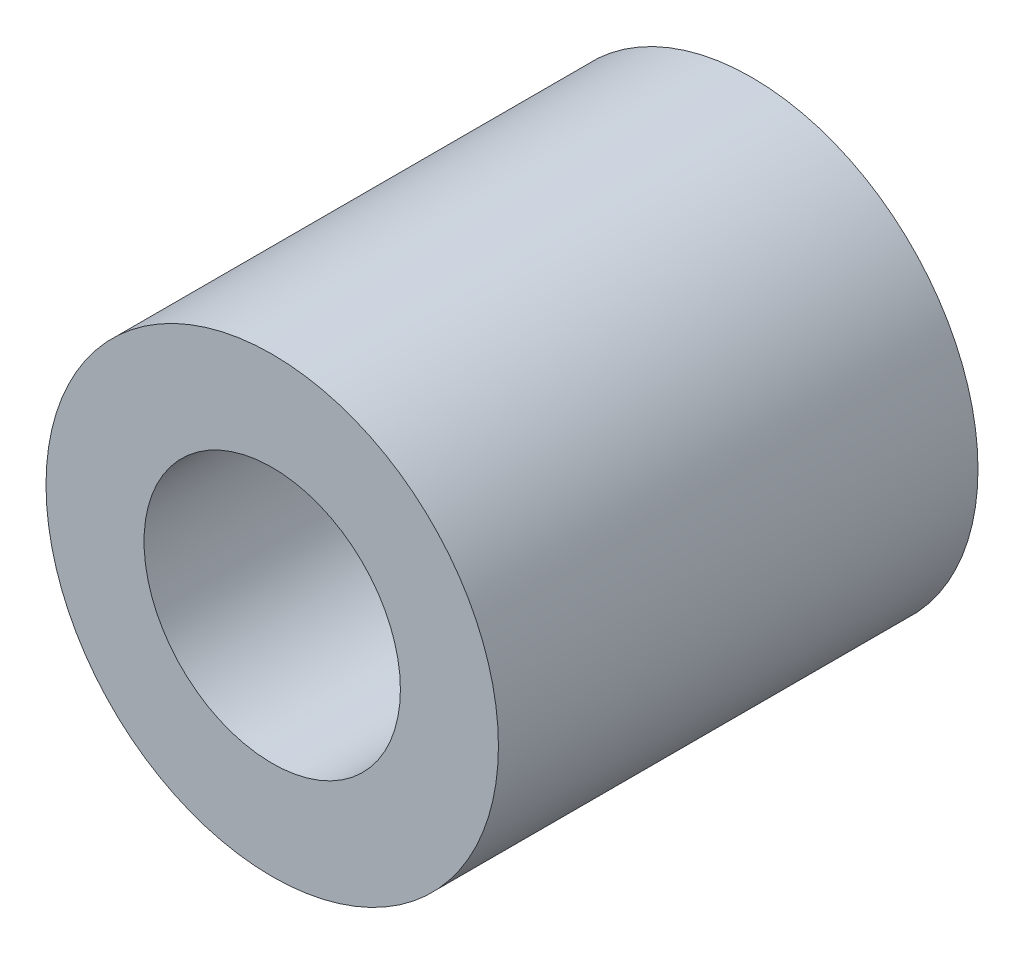
from build123d import *

# Parameters (mm, degrees)
SKETCH2_R           = 7.5
SKETCH2_R_2         = 4.25
BOSS_EXTRUDE1_DEPTH = 15.9


with BuildPart() as part:
    # Sketch2 → Boss-Extrude1 (new body)
    with BuildSketch(Plane.XY):
        Circle(SKETCH2_R)
        Circle(SKETCH2_R_2, mode=Mode.SUBTRACT)
    extrude(amount=BOSS_EXTRUDE1_DEPTH)


solid = part.part
